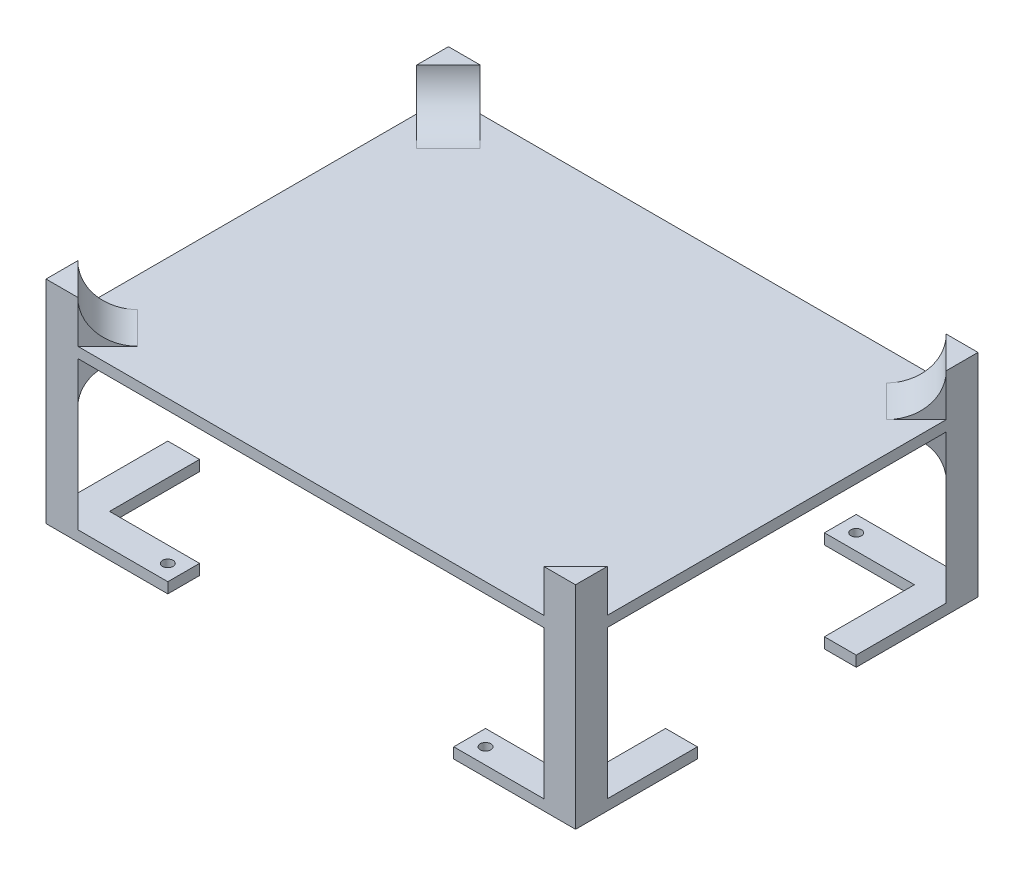
from build123d import *

# Parameters (mm, degrees)
BOSS_EXTRUDE1_DEPTH   = 100
BOSS_EXTRUDE1_2_DEPTH = 100
BOSS_EXTRUDE1_3_DEPTH = 100
BOSS_EXTRUDE1_4_DEPTH = 100
SKETCH3_W             = 190
SKETCH3_H             = 5
BOSS_EXTRUDE3_DEPTH   = 250
SKETCH5_R             = 2.5
BOSS_EXTRUDE6_DEPTH   = 5
BOSS_EXTRUDE7_DEPTH   = 45
CUT_EXTRUDE2_REACH    = 197.096
CUT_EXTRUDE3_REACH    = 215.454
CUT_EXTRUDE4_REACH    = 197.096
CUT_EXTRUDE5_REACH    = 215.454


with BuildPart() as part:
    # Sketch1 → Boss-Extrude1 (new body)
    with BuildSketch(Plane(origin=(0, 0, 0), x_dir=(1, 0, 0), z_dir=(0, 1, 0))):
        Polygon((-125, 95), (-125, 80), (-110, 95), align=None)
    extrude(amount=BOSS_EXTRUDE1_DEPTH)



with BuildPart() as body_2:
    # Sketch1 → Boss-Extrude1 2 (new body)
    with BuildSketch(Plane(origin=(0, 0, 0), x_dir=(1, 0, 0), z_dir=(0, 1, 0))):
        Polygon((125, 95), (110, 95), (125, 80), align=None)
    extrude(amount=BOSS_EXTRUDE1_2_DEPTH)


with BuildPart() as body_3:
    # Sketch1 → Boss-Extrude1 3 (new body)
    with BuildSketch(Plane(origin=(0, 0, 0), x_dir=(1, 0, 0), z_dir=(0, 1, 0))):
        Polygon((125, -95), (125, -80), (110, -95), align=None)
    extrude(amount=BOSS_EXTRUDE1_3_DEPTH)


with BuildPart() as body_4:
    # Sketch1 → Boss-Extrude1 4 (new body)
    with BuildSketch(Plane(origin=(0, 0, 0), x_dir=(1, 0, 0), z_dir=(0, 1, 0))):
        Polygon((-125, -95), (-110, -95), (-125, -80), align=None)
    extrude(amount=BOSS_EXTRUDE1_4_DEPTH)


with BuildPart() as part_1:
    add(part.part)

    add(body_2.part)  # Boss-Extrude3 merges body 2

    add(body_3.part)  # Boss-Extrude3 merges body 3

    add(body_4.part)  # Boss-Extrude3 merges body 4
    # Sketch3 → Boss-Extrude3 (add, through all)
    with BuildSketch(Plane(origin=(125, 0, 0), x_dir=(0, 0, -1), z_dir=(1, 0, 0))):
        with Locations((0, 77.5)):
            Rectangle(SKETCH3_W, SKETCH3_H)
    extrude(amount=-BOSS_EXTRUDE3_DEPTH)

    # Sketch5 → Boss-Extrude6 (add)
    # profile 1 of 4: a face of its own
    with BuildSketch(Plane.XZ):
        Polygon((-110, 80), (-110, 37.5), (-125, 37.5), (-125, 95), (-67.5, 95), (-67.5, 80), align=None)
        with Locations(Location((-75, 87.5, 0), (0, 0, 270))):
            Circle(SKETCH5_R, mode=Mode.SUBTRACT)
    # profile 2 of 4: a face of its own
    with BuildSketch(Plane.XZ):
        Polygon((125, 95), (67.5, 95), (67.5, 80), (110, 80), (110, 37.5), (125, 37.5), align=None)
        with Locations(Location((75, 87.5, 0), (0, 0, 90))):
            Circle(SKETCH5_R, mode=Mode.SUBTRACT)
    # profile 3 of 4: a face of its own
    with BuildSketch(Plane.XZ):
        Polygon((110, -80), (110, -37.5), (125, -37.5), (125, -95), (67.5, -95), (67.5, -80), align=None)
        with Locations(Location((75, -87.5, 0), (0, 0, 270))):
            Circle(SKETCH5_R, mode=Mode.SUBTRACT)
    # profile 4 of 4: a face of its own
    with BuildSketch(Plane.XZ):
        Polygon((-125, -95), (-67.5, -95), (-67.5, -80), (-110, -80), (-110, -37.5), (-125, -37.5), align=None)
        with Locations(Location((-75, -87.5, 0), (0, 0, 90))):
            Circle(SKETCH5_R, mode=Mode.SUBTRACT)
    extrude(amount=-BOSS_EXTRUDE6_DEPTH)

    # Sketch9 → Boss-Extrude7 (add)
    with BuildSketch(Plane(origin=(0, 100, 0), x_dir=(1, 0, 0), z_dir=(0, 1, 0))):
        Polygon((-110, 95), (-125, 80), (-110.857864376, 65.857864376), (-95.857864376, 80.857864376), align=None)
        Polygon((110, 95), (95.857864376, 80.857864376), (110.857864376, 65.857864376), (125, 80), align=None)
        Polygon((110, -95), (125, -80), (110.857864376, -65.857864376), (95.857864376, -80.857864376), align=None)
        Polygon((-110, -95), (-95.857864376, -80.857864376), (-110.857864376, -65.857864376), (-125, -80), align=None)
    extrude(amount=-BOSS_EXTRUDE7_DEPTH)

    # Sketch11 → Cut-Extrude2 (cut, up to next)
    with BuildSketch(Plane(origin=(7.5, 0, -7.5), x_dir=(0.7071067811865489, 0, 0.7071067811865461), z_dir=(-0.7071067811865461, 0, 0.7071067811865489)), mode=Mode.PRIVATE) as cut_extrude2_sk1:
        with BuildLine():
            Line((124.956890143, 80), (124.956890143, 100))
            Line((124.956890143, 100), (144.956890143, 100))
            ThreePointArc((144.956890143, 100), (139.099025767, 85.857864376), (124.956890143, 80))
        make_face()
    cut_extrude2_tool1 = extrude(cut_extrude2_sk1.sketch, amount=-CUT_EXTRUDE2_REACH, mode=Mode.PRIVATE) & part_1.part
    # Sketch11 → Cut-Extrude2 (cut, up to next)
    with BuildSketch(Plane(origin=(7.5, 0, -7.5), x_dir=(0.7071067811865489, 0, 0.7071067811865461), z_dir=(-0.7071067811865461, 0, 0.7071067811865489)), mode=Mode.PRIVATE) as cut_extrude2_sk2:
        with BuildLine():
            Line((124.956890143, 75), (124.956890143, 55))
            Line((124.956890143, 55), (144.956890143, 55))
            ThreePointArc((144.956890143, 55), (139.099025767, 69.142135624), (124.956890143, 75))
        make_face()
    cut_extrude2_tool2 = extrude(cut_extrude2_sk2.sketch, amount=-CUT_EXTRUDE2_REACH, mode=Mode.PRIVATE) & part_1.part
    add(cut_extrude2_tool1.solids().sort_by_distance((101.859973, 91.511736, 86.859973))[0], mode=Mode.SUBTRACT)
    add(cut_extrude2_tool2.solids().sort_by_distance((101.859973, 63.488264, 86.859973))[0], mode=Mode.SUBTRACT)

    # Sketch12 → Cut-Extrude3 (cut, up to next)
    with BuildSketch(Plane(origin=(22.5, 0, 22.5), x_dir=(0.7071067811865471, 0, -0.7071067811865479), z_dir=(0.7071067811865479, 0, 0.7071067811865471)), mode=Mode.PRIVATE) as cut_extrude3_sk1:
        with BuildLine():
            Line((144.956890143, 100), (124.956890143, 100))
            Line((124.956890143, 100), (124.956890143, 80))
            ThreePointArc((124.956890143, 80), (139.099025767, 85.857864376), (144.956890143, 100))
        make_face()
    cut_extrude3_tool1 = extrude(cut_extrude3_sk1.sketch, amount=-CUT_EXTRUDE3_REACH, mode=Mode.PRIVATE) & part_1.part
    # Sketch12 → Cut-Extrude3 (cut, up to next)
    with BuildSketch(Plane(origin=(22.5, 0, 22.5), x_dir=(0.7071067811865471, 0, -0.7071067811865479), z_dir=(0.7071067811865479, 0, 0.7071067811865471)), mode=Mode.PRIVATE) as cut_extrude3_sk2:
        with BuildLine():
            Line((144.956890143, 55), (124.956890143, 55))
            Line((124.956890143, 55), (124.956890143, 75))
            ThreePointArc((124.956890143, 75), (139.099025767, 69.142135624), (144.956890143, 55))
        make_face()
    cut_extrude3_tool2 = extrude(cut_extrude3_sk2.sketch, amount=-CUT_EXTRUDE3_REACH, mode=Mode.PRIVATE) & part_1.part
    add(cut_extrude3_tool1.solids().sort_by_distance((116.859973, 91.511736, -71.859973))[0], mode=Mode.SUBTRACT)
    add(cut_extrude3_tool2.solids().sort_by_distance((116.859973, 63.488264, -71.859973))[0], mode=Mode.SUBTRACT)

    # Sketch13 → Cut-Extrude4 (cut, up to next)
    with BuildSketch(Plane(origin=(-7.5, 0, -7.5), x_dir=(0.7071067811865482, 0, -0.7071067811865468), z_dir=(0.7071067811865468, 0, 0.7071067811865482)), mode=Mode.PRIVATE) as cut_extrude4_sk1:
        with BuildLine():
            Line((-144.956890143, 100), (-124.956890143, 100))
            Line((-124.956890143, 100), (-124.956890143, 80))
            ThreePointArc((-124.956890143, 80), (-139.099025767, 85.857864376), (-144.956890143, 100))
        make_face()
    cut_extrude4_tool1 = extrude(cut_extrude4_sk1.sketch, amount=-CUT_EXTRUDE4_REACH, mode=Mode.PRIVATE) & part_1.part
    # Sketch13 → Cut-Extrude4 (cut, up to next)
    with BuildSketch(Plane(origin=(-7.5, 0, -7.5), x_dir=(0.7071067811865482, 0, -0.7071067811865468), z_dir=(0.7071067811865468, 0, 0.7071067811865482)), mode=Mode.PRIVATE) as cut_extrude4_sk2:
        with BuildLine():
            Line((-124.956890143, 75), (-124.956890143, 55))
            Line((-124.956890143, 55), (-144.956890143, 55))
            ThreePointArc((-144.956890143, 55), (-139.099025767, 69.142135624), (-124.956890143, 75))
        make_face()
    cut_extrude4_tool2 = extrude(cut_extrude4_sk2.sketch, amount=-CUT_EXTRUDE4_REACH, mode=Mode.PRIVATE) & part_1.part
    add(cut_extrude4_tool1.solids().sort_by_distance((-101.859973, 91.511736, 86.859973))[0], mode=Mode.SUBTRACT)
    add(cut_extrude4_tool2.solids().sort_by_distance((-101.859973, 63.488264, 86.859973))[0], mode=Mode.SUBTRACT)

    # Sketch14 → Cut-Extrude5 (cut, up to next)
    with BuildSketch(Plane(origin=(-22.5, 0, 22.5), x_dir=(0.7071067811865471, 0, 0.7071067811865479), z_dir=(-0.7071067811865479, 0, 0.7071067811865471)), mode=Mode.PRIVATE) as cut_extrude5_sk1:
        with BuildLine():
            Line((-144.956890143, 100), (-124.956890143, 100))
            Line((-124.956890143, 100), (-124.956890143, 80))
            ThreePointArc((-124.956890143, 80), (-139.099025767, 85.857864376), (-144.956890143, 100))
        make_face()
    cut_extrude5_tool1 = extrude(cut_extrude5_sk1.sketch, amount=-CUT_EXTRUDE5_REACH, mode=Mode.PRIVATE) & part_1.part
    # Sketch14 → Cut-Extrude5 (cut, up to next)
    with BuildSketch(Plane(origin=(-22.5, 0, 22.5), x_dir=(0.7071067811865471, 0, 0.7071067811865479), z_dir=(-0.7071067811865479, 0, 0.7071067811865471)), mode=Mode.PRIVATE) as cut_extrude5_sk2:
        with BuildLine():
            Line((-144.956890143, 55), (-124.956890143, 55))
            Line((-124.956890143, 55), (-124.956890143, 75))
            ThreePointArc((-124.956890143, 75), (-139.099025767, 69.142135624), (-144.956890143, 55))
        make_face()
    cut_extrude5_tool2 = extrude(cut_extrude5_sk2.sketch, amount=-CUT_EXTRUDE5_REACH, mode=Mode.PRIVATE) & part_1.part
    add(cut_extrude5_tool1.solids().sort_by_distance((-116.859973, 91.511736, -71.859973))[0], mode=Mode.SUBTRACT)
    add(cut_extrude5_tool2.solids().sort_by_distance((-116.859973, 63.488264, -71.859973))[0], mode=Mode.SUBTRACT)


solid = part_1.part
